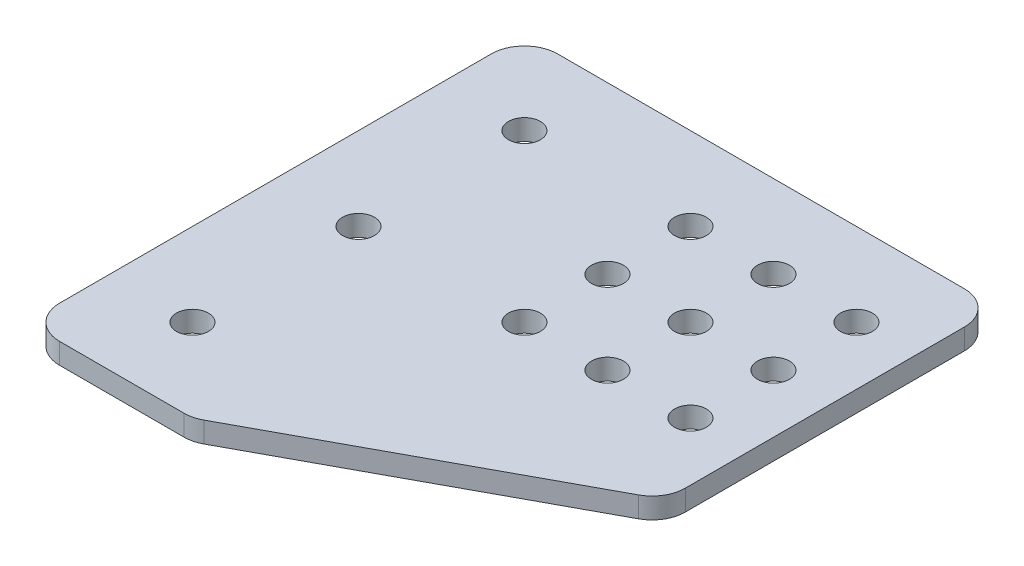
from build123d import *

# Parameters (mm, degrees)
SKETCH1_R           = 2.4384
BOSS_EXTRUDE1_DEPTH = 3.175
FILLET3_R           = 5.08


with BuildPart() as part:
    # Sketch1 → Boss-Extrude1 (new body)
    with BuildSketch(Plane(origin=(0, 0, 0), x_dir=(1, 0, 0), z_dir=(0, 1, 0))):
        with BuildLine():
            ThreePointArc((5.08, 0), (1.487897552, -1.487897552), (0, -5.08))
            Line((0, -5.08), (0, -71.12))
            ThreePointArc((0, -71.12), (1.487897552, -74.712102448), (5.08, -76.2))
            Line((5.08, -76.2), (25.4, -76.2))
            Line((25.4, -76.2), (72.39, -50.8))
            Line((72.39, -50.8), (72.39, 0))
            Line((72.39, 0), (5.08, 0))
        make_face()
        with Locations(Location((50.8, -38.1, 0), (0, 0, 270))):
            Circle(SKETCH1_R, mode=Mode.SUBTRACT)
        with Locations(Location((50.8, -25.4, 0), (0, 0, 270))):
            Circle(SKETCH1_R, mode=Mode.SUBTRACT)
        with Locations(Location((50.8, -12.7, 0), (0, 0, 270))):
            Circle(SKETCH1_R, mode=Mode.SUBTRACT)
        with Locations(Location((12.7, -63.5, 0), (0, 0, 270))):
            Circle(SKETCH1_R, mode=Mode.SUBTRACT)
        with Locations(Location((63.5, -38.1, 0), (0, 0, 270))):
            Circle(SKETCH1_R, mode=Mode.SUBTRACT)
        with Locations(Location((63.5, -25.4, 0), (0, 0, 270))):
            Circle(SKETCH1_R, mode=Mode.SUBTRACT)
        with Locations(Location((63.5, -12.7, 0), (0, 0, 270))):
            Circle(SKETCH1_R, mode=Mode.SUBTRACT)
        with Locations(Location((12.7, -38.1, 0), (0, 0, 270))):
            Circle(SKETCH1_R, mode=Mode.SUBTRACT)
        with Locations(Location((12.7, -12.7, 0), (0, 0, 270))):
            Circle(SKETCH1_R, mode=Mode.SUBTRACT)
        with Locations(Location((38.1, -38.1, 0), (0, 0, 270))):
            Circle(SKETCH1_R, mode=Mode.SUBTRACT)
        with Locations(Location((38.1, -25.4, 0), (0, 0, 270))):
            Circle(SKETCH1_R, mode=Mode.SUBTRACT)
        with Locations(Location((38.1, -12.7, 0), (0, 0, 270))):
            Circle(SKETCH1_R, mode=Mode.SUBTRACT)
    extrude(amount=BOSS_EXTRUDE1_DEPTH)

    # Fillet3
    fillet3_edges = [part.edges().sort_by_distance(p)[0] for p in [
        (72.39, 1.5875, 0),
        (72.39, 1.5875, 50.8),
        (25.4, 1.5875, 76.2),
    ]]
    fillet(fillet3_edges, radius=FILLET3_R)


solid = part.part
